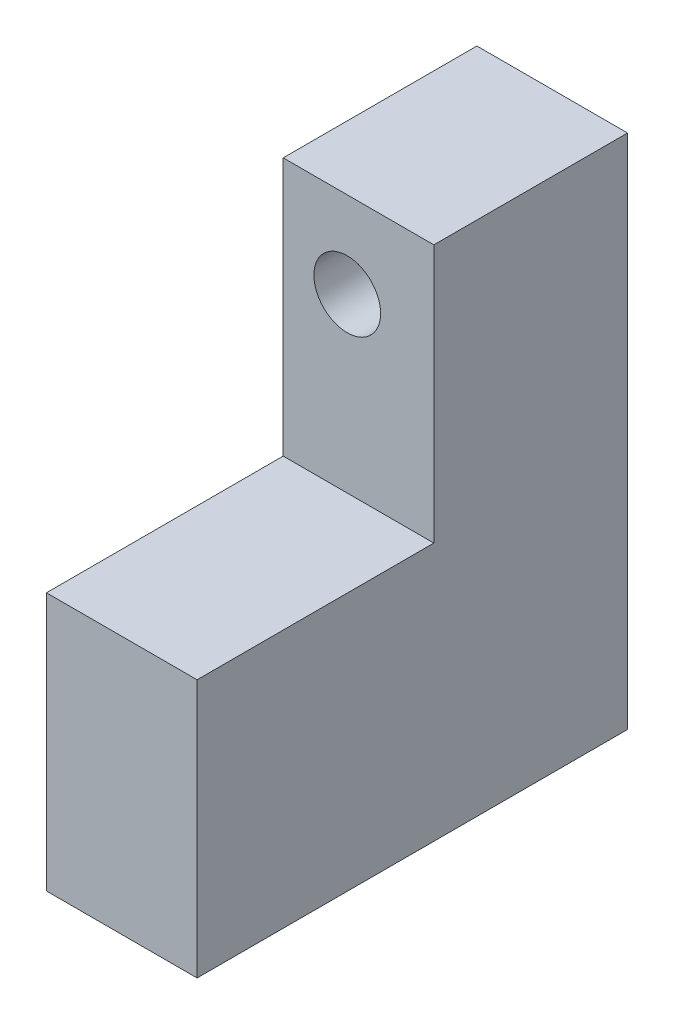
from build123d import *

# Parameters (mm, degrees)
SKETCH_1_W          = 7
SKETCH_1_H          = 24
SKETCH_1_R          = 1.55
EXTRUDE_1_DEPTH     = 9
SKETCH_2_W          = 7
SKETCH_2_H          = 12
EXTRUDE_2_DEPTH     = 11
SKETCH_3_R          = 1.55
CUT_EXTRUDE_1_DEPTH = 5


with BuildPart() as part:
    # 草图1 → 凸台-拉伸1 (new body)
    with BuildSketch(Plane.XY):
        with Locations((3.525062814, 16.5)):
            Rectangle(SKETCH_1_W, SKETCH_1_H)
        with Locations((3, 24.5)):
            Circle(SKETCH_1_R, mode=Mode.SUBTRACT)
    extrude(amount=EXTRUDE_1_DEPTH)

    # 草图2 → 凸台-拉伸2 (add)
    with BuildSketch(Plane.XY.offset(9)):
        with Locations((3.525062814, 10.5)):
            Rectangle(SKETCH_2_W, SKETCH_2_H)
    extrude(amount=EXTRUDE_2_DEPTH)

    # 草图3 → 切除-拉伸1 (cut)
    with BuildSketch(Plane(origin=(0, 4.5, 0), x_dir=(-1, 0, 0), z_dir=(0, -1, 0))):
        with Locations(Location((-3.525062814, -5, 0), (0, 0, 180))):
            Circle(SKETCH_3_R)
        with Locations(Location((-3.525062814, -15, 0), (0, 0, 180))):
            Circle(SKETCH_3_R)
    extrude(amount=-CUT_EXTRUDE_1_DEPTH, mode=Mode.SUBTRACT)


solid = part.part
